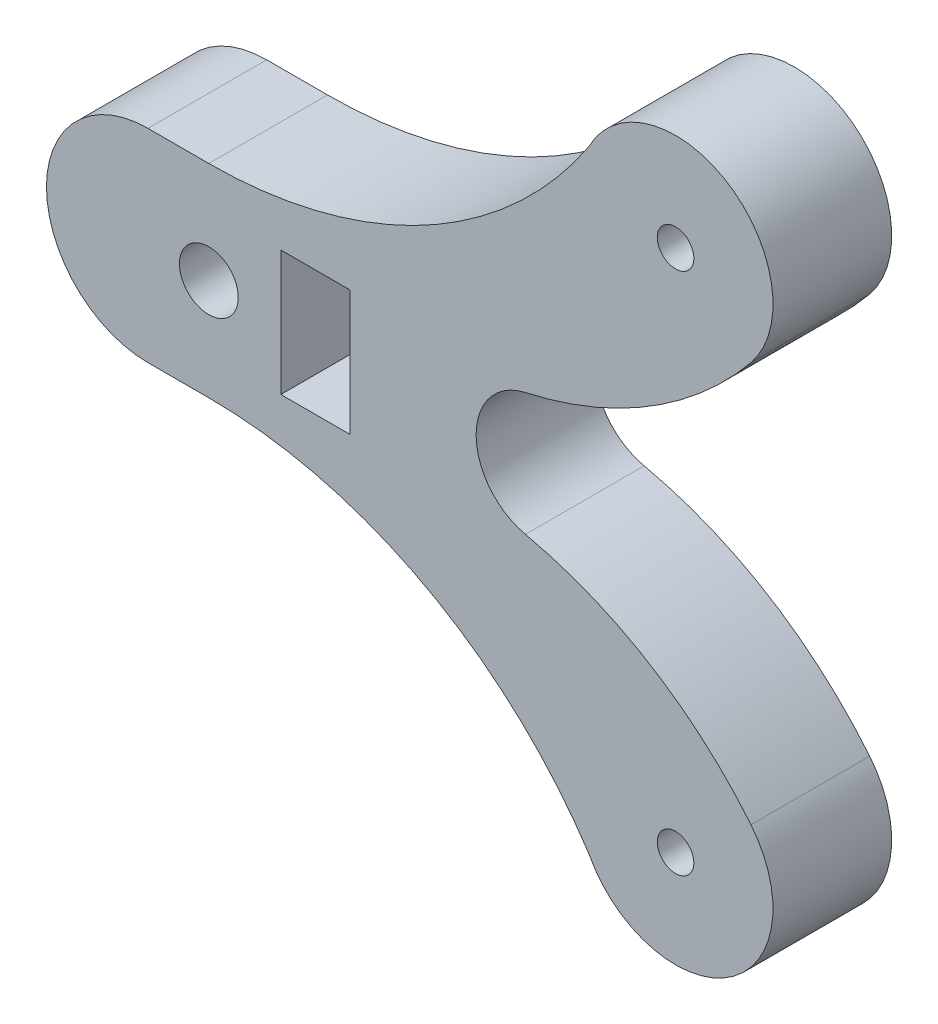
from build123d import *

# Parameters (mm, degrees)
SKETCH1_R           = 0.9
SKETCH1_R_2         = 1.449813
SKETCH1_W           = 3.400011
SKETCH1_H           = 6.165
BOSS_EXTRUDE1_DEPTH = 5.85


with BuildPart() as part:
    # Sketch1 → Boss-Extrude1 (new body)
    with BuildSketch(Plane.XY):
        with BuildLine():
            Line((588.919699582, 440.365819013), (585.919699582, 440.365819013))
            ThreePointArc((585.919699582, 440.365819013), (580.919699582, 435.365819013), (585.919699582, 430.365819013))
            Line((585.919699582, 430.365819013), (588.919699582, 430.365819013))
            ThreePointArc((588.919699582, 430.365819013), (599.557918625, 427.682003659), (607.649897061, 420.272924481))
            ThreePointArc((607.649897061, 420.272924481), (614.550865316, 418.451224777), (615.634267587, 425.505882259))
            ThreePointArc((615.634267587, 425.505882259), (610.653294544, 429.857960207), (604.521800574, 432.33897948))
            ThreePointArc((604.521800574, 432.33897948), (602.091309675, 435.365819013), (604.521800574, 438.392658547))
            ThreePointArc((604.521800574, 438.392658547), (610.653294544, 440.87367782), (615.634267587, 445.225755768))
            ThreePointArc((615.634267587, 445.225755768), (614.550865316, 452.28041325), (607.649897061, 450.458713546))
            ThreePointArc((607.649897061, 450.458713546), (599.557918625, 443.049634368), (588.919699582, 440.365819013))
        make_face()
        with Locations((611.919699582, 448.265819013)):
            Circle(SKETCH1_R, mode=Mode.SUBTRACT)
        with Locations((611.919699582, 422.465819013)):
            Circle(SKETCH1_R, mode=Mode.SUBTRACT)
        with Locations((588.919699582, 435.365819013)):
            Circle(SKETCH1_R_2, mode=Mode.SUBTRACT)
        with Locations((594.169518082, 435.365819013)):
            Rectangle(SKETCH1_W, SKETCH1_H, mode=Mode.SUBTRACT)
    extrude(amount=BOSS_EXTRUDE1_DEPTH)


solid = part.part
